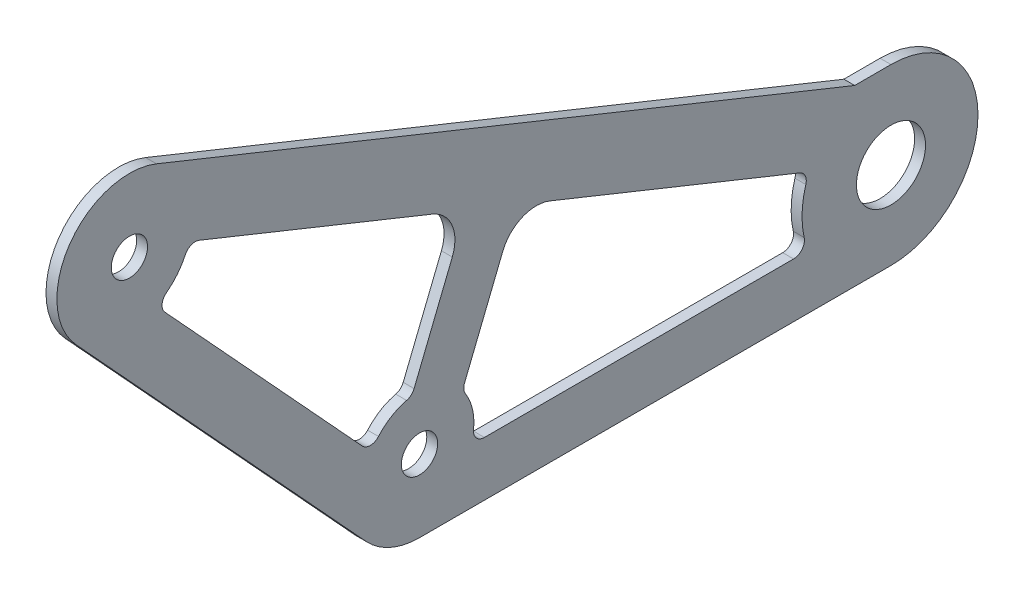
from build123d import *

# Parameters (mm, degrees)
BOSS_EXTRUDE1_DEPTH         = 3
F_3_4_0_75_DIAMETER_HOLE1_D = 19.05
F_10_0_10_DIAMETER_HOLE1_D  = 10
F_10_0_10_DIAMETER_HOLE2_D  = 10
CUT_EXTRUDE1_REACH          = 210.238


with BuildPart() as part:
    # Sketch1 → Boss-Extrude1 (new body)
    with BuildSketch(Plane(origin=(0, 0, 0), x_dir=(0, 0, -1), z_dir=(1, 0, 0))):
        with BuildLine():
            Line((-65, 0), (65, 0))
            ThreePointArc((65, 0), (89, 24), (65, 48))
            Line((65, 48), (55, 48))
            Line((55, 48), (-137.527302422, 125.551517213))
            ThreePointArc((-137.527302422, 125.551517213), (-161.448822218, 118.377005214), (-159.721992414, 93.462535711))
            Line((-159.721992414, 93.462535711), (-79.721992414, 6.462535711))
            ThreePointArc((-79.721992414, 6.462535711), (-73.038989807, 1.686763178), (-65, 0))
        make_face()
    extrude(amount=BOSS_EXTRUDE1_DEPTH)

    # 3/4 (0.75) Diameter Hole1 (through all)
    with Locations(Plane(origin=(3, 0, 0), x_dir=(0, 0, -1), z_dir=(1, 0, 0))):
        with Locations((65, 24)):
            Hole(F_3_4_0_75_DIAMETER_HOLE1_D / 2)

    # Ø10.0 (10) Diameter Hole1 (through all)
    with Locations(Plane(origin=(3, 0, 0), x_dir=(0, 0, -1), z_dir=(1, 0, 0))):
        with Locations((-145, 107)):
            Hole(F_10_0_10_DIAMETER_HOLE1_D / 2)

    # Ø10.0 (10) Diameter Hole2 (through all)
    with Locations(Plane(origin=(3, 0, 0), x_dir=(0, 0, -1), z_dir=(1, 0, 0))):
        with Locations((-65, 20)):
            Hole(F_10_0_10_DIAMETER_HOLE2_D / 2)

    # Sketch8 → Cut-Extrude1 (cut, up to next)
    with BuildSketch(Plane(origin=(3, 0, 0), x_dir=(0, 0, -1), z_dir=(1, 0, 0)), mode=Mode.PRIVATE) as cut_extrude1_sk1:
        with BuildLine():
            Line((38.136909616, 15), (-47.11145618, 15))
            ThreePointArc((-47.11145618, 15), (-49.347524158, 16), (-50.09288015, 18.333333333))
            ThreePointArc((-50.09288015, 18.333333333), (-50.384311526, 23.373670173), (-52.331533313, 28.031808751))
            ThreePointArc((-52.331533313, 28.031808751), (-52.785410617, 29.365367154), (-52.580567558, 30.759075138))
            Line((-52.580567558, 30.759075138), (-42.048503485, 56.905692997))
            ThreePointArc((-42.048503485, 56.905692997), (-36.689699124, 62.370293585), (-29.036396089, 62.445102815))
            Line((-29.036396089, 62.445102815), (39.768193948, 34.730070809))
            ThreePointArc((39.768193948, 34.730070809), (41.351904066, 33.245441463), (41.519519359, 31.08114778))
            ThreePointArc((41.519519359, 31.08114778), (40.491403893, 24.896851079), (41.064766878, 18.653950954))
            ThreePointArc((41.064766878, 18.653950954), (40.478047465, 16.124080607), (38.136909616, 15))
        make_face()
    cut_extrude1_tool1 = extrude(cut_extrude1_sk1.sketch, amount=-CUT_EXTRUDE1_REACH, mode=Mode.PRIVATE) & part.part
    # Sketch8 → Cut-Extrude1 (cut, up to next)
    with BuildSketch(Plane(origin=(3, 0, 0), x_dir=(0, 0, -1), z_dir=(1, 0, 0)), mode=Mode.PRIVATE) as cut_extrude1_sk2:
        with BuildLine():
            Line((-135.210891206, 88.967436427), (-80.78877426, 29.783384249))
            ThreePointArc((-80.78877426, 29.783384249), (-78.53914012, 28.814288673), (-76.317062832, 29.845003243))
            ThreePointArc((-76.317062832, 29.845003243), (-72.806710034, 32.808406554), (-68.564110875, 34.570419132))
            ThreePointArc((-68.564110875, 34.570419132), (-67.312603666, 35.217035191), (-66.494205468, 36.363598321))
            Line((-66.494205468, 36.363598321), (-55.962141395, 62.51021618))
            ThreePointArc((-55.962141395, 62.51021618), (-56.036950624, 70.163519215), (-61.501551212, 75.522323576))
            Line((-61.501551212, 75.522323576), (-125.724416937, 101.391800861))
            ThreePointArc((-125.724416937, 101.391800861), (-127.951011637, 101.397881175), (-129.568523338, 99.867712287))
            ThreePointArc((-129.568523338, 99.867712287), (-131.78341646, 96.307857113), (-134.802203492, 93.39834766))
            ThreePointArc((-134.802203492, 93.39834766), (-135.989912088, 91.27359327), (-135.210891206, 88.967436427))
        make_face()
    cut_extrude1_tool2 = extrude(cut_extrude1_sk2.sketch, amount=-CUT_EXTRUDE1_REACH, mode=Mode.PRIVATE) & part.part
    add(cut_extrude1_tool1.solids().sort_by_distance((3, 33.678975, 9.935065))[0], mode=Mode.SUBTRACT)
    add(cut_extrude1_tool2.solids().sort_by_distance((3, 67.393587, 91.526905))[0], mode=Mode.SUBTRACT)


solid = part.part
